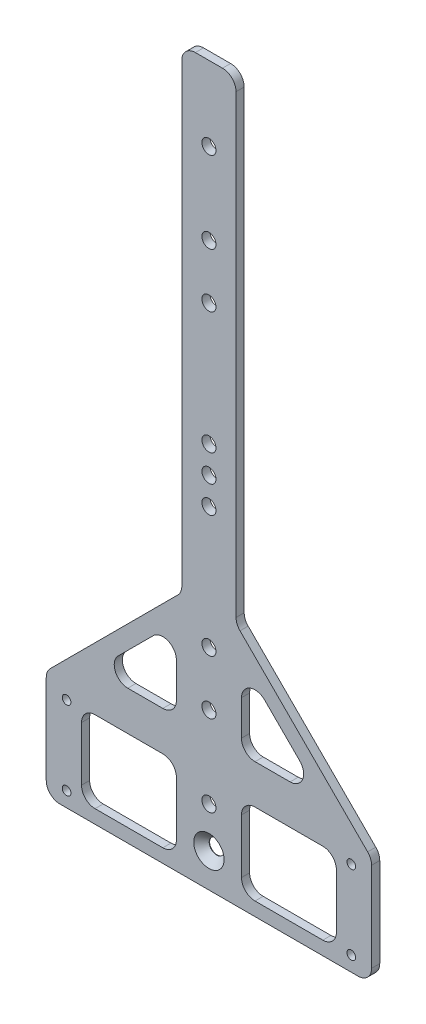
from build123d import *

# Parameters (mm, degrees)
SKETCH_1_R          = 1.6
SKETCH_1_R_2        = 2.6
EXTRUDE_1_DEPTH     = 1.5
SKETCH_2_R          = 2.6
CUT_EXTRUDE_1_DEPTH = 253.257804636
SKETCH_3_W          = 35
SKETCH_3_H          = 30
CUT_EXTRUDE_2_DEPTH = 253.257804636
FILLET_1_R          = 5


with BuildPart() as part:
    # 草图1 → 凸台-拉伸1 (new, symmetric)
    with BuildSketch(Plane.XY):
        Polygon((-60, 20), (-60, -20), (60, -20), (60, 20), (10, 70), (10, 245), (-10, 245), (-10, 70), align=None)
        with Locations((-52.5, -14.5)):
            Circle(SKETCH_1_R, mode=Mode.SUBTRACT)
        with Locations((52.5, -14.5)):
            Circle(SKETCH_1_R, mode=Mode.SUBTRACT)
        with Locations((52.5, 14.5)):
            Circle(SKETCH_1_R, mode=Mode.SUBTRACT)
        with Locations((-52.5, 14.5)):
            Circle(SKETCH_1_R, mode=Mode.SUBTRACT)
        with Locations((0, 7.5)):
            Circle(SKETCH_1_R_2, mode=Mode.SUBTRACT)
        with Locations((0, -7.5)):
            Circle(SKETCH_1_R_2, mode=Mode.SUBTRACT)
    extrude(amount=EXTRUDE_1_DEPTH, both=True)

    # 草图2 → 切除-拉伸1 (cut, through all)
    with BuildSketch(Plane.XY.offset(1.5)):
        with Locations((0, 217.5)):
            Circle(SKETCH_2_R)
        with Locations((0, 187.5)):
            Circle(SKETCH_2_R)
        with Locations((0, 167.5)):
            Circle(SKETCH_2_R)
        with Locations((0, 122.5)):
            Circle(SKETCH_2_R)
        with Locations((0, 112.5)):
            Circle(SKETCH_2_R)
        with Locations((0, 102.5)):
            Circle(SKETCH_2_R)
        with Locations((0, 57.5)):
            Circle(SKETCH_2_R)
        with Locations((0, 37.5)):
            Circle(SKETCH_2_R)
    extrude(amount=-CUT_EXTRUDE_1_DEPTH, mode=Mode.SUBTRACT)

    # 草图3 → 切除-拉伸2 (cut, through all)
    with BuildSketch(Plane.XY.offset(1.5)):
        Polygon((-42, 29.514718626), (-12, 29.514718626), (-12, 59.514718626), align=None)
        with Locations((-29.5, 0)):
            Rectangle(SKETCH_3_W, SKETCH_3_H)
    cut_extrude_2 = extrude(amount=-CUT_EXTRUDE_2_DEPTH, mode=Mode.SUBTRACT)

    # 镜向1: 切除-拉伸2 across plane
    add(cut_extrude_2.mirror(Plane(origin=(0, 0, 0), x_dir=(0, 0, 1), z_dir=(1, 0, 0))), mode=Mode.SUBTRACT)

    # 圆角1
    fillet_1_edges = [part.edges().sort_by_distance(p)[0] for p in [
        (12, 59.514718626, 0),
        (42, 29.514718626, 0),
        (12, 29.514718626, 0),
        (12, 15, 0),
        (47, 15, 0),
        (47, -15, 0),
        (12, -15, 0),
        (60, -20, 0),
        (-60, -20, 0),
        (-60, 20, 0),
        (-10, 70, 0),
        (-10, 245, 0),
        (10, 245, 0),
        (10, 70, 0),
        (60, 20, 0),
        (-42, 29.514718626, 0),
        (-12, 59.514718626, 0),
        (-12, 29.514718626, 0),
        (-47, 15, 0),
        (-12, 15, 0),
        (-12, -15, 0),
        (-47, -15, 0),
    ]]
    fillet(fillet_1_edges, radius=FILLET_1_R)

    # 草图5 → M5 六角凹锥坑螺钉的锥形沉头孔1 (revolve, cut)
    with BuildSketch(Plane(origin=(0, -7.5, 1.5), x_dir=(0, -1, 0), z_dir=(1, 0, 0))):
        Polygon((0, 0), (0, 3), (2.75, 3), (2.75, 2.85), (5.6, 0), align=None)
    revolve(axis=Axis((0, -7.5, 7.85), (0, 0, -1)), mode=Mode.SUBTRACT)


solid = part.part
